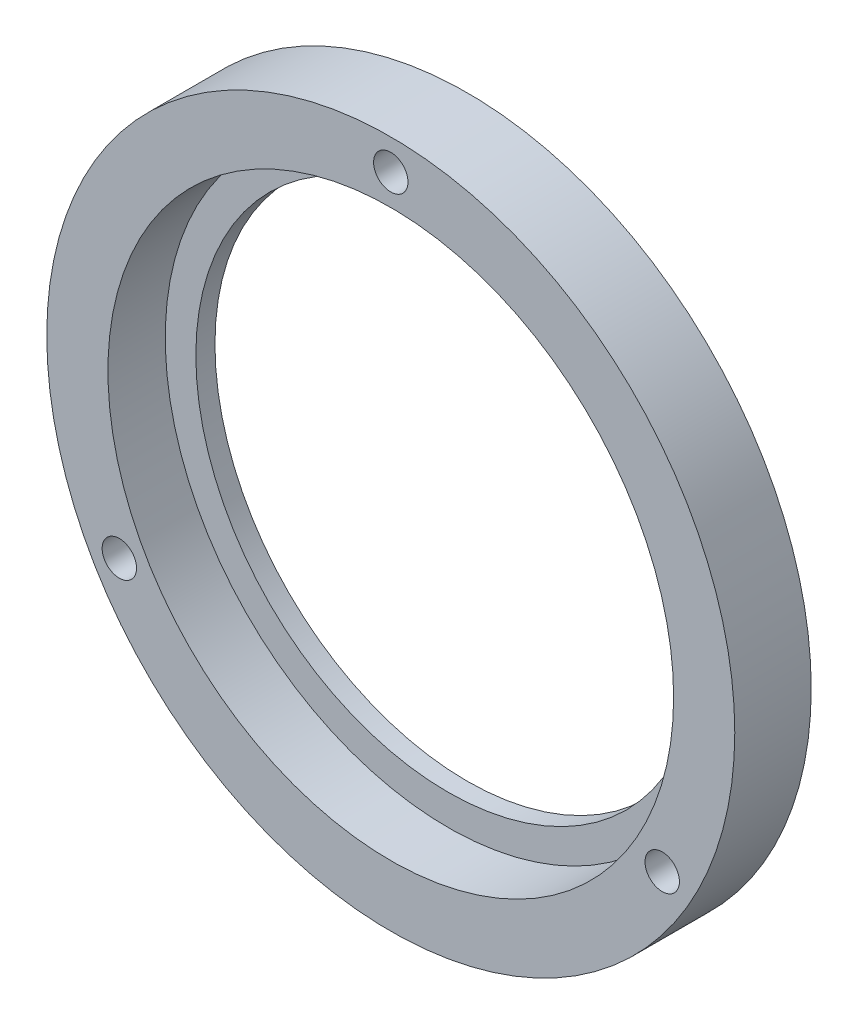
from build123d import *

# Parameters (mm, degrees)
ESQUISSE2_R                  = 2.25
ENL_V_MAT_EXTRU_1_DEPTH      = 65.420493634
R_P_TITION_CIRCULAIRE1_COUNT = 3


with BuildPart() as part:
    # Esquisse1 → Base-Révolution (revolve)
    with BuildSketch(Plane(origin=(0, 0, 0), x_dir=(1, 0, 0), z_dir=(0, 1, 0))):
        Polygon((33, 10), (45, 10), (45, 0), (37, 0), (37, 7.5), (33, 7.5), align=None)
    revolve(axis=Axis((0, 0, 30), (0, 0, -1)))

    # Esquisse2 → Enlèv. mat.-Extru.1 (cut, through all)
    with BuildSketch(Plane.XY):
        with Locations((0, 41)):
            Circle(ESQUISSE2_R)
    enl_v_mat_extru_1 = extrude(amount=-ENL_V_MAT_EXTRU_1_DEPTH, mode=Mode.SUBTRACT)

    # Répétition circulaire1: Enlèv. mat.-Extru.1 ×3 about axis
    r_p_tition_circulaire1_axis = Axis((0, 0, 0), (0, 0, 1))
    for i in range(1, R_P_TITION_CIRCULAIRE1_COUNT):
        add(enl_v_mat_extru_1.rotate(r_p_tition_circulaire1_axis, i * 360 / R_P_TITION_CIRCULAIRE1_COUNT), mode=Mode.SUBTRACT)


solid = part.part
